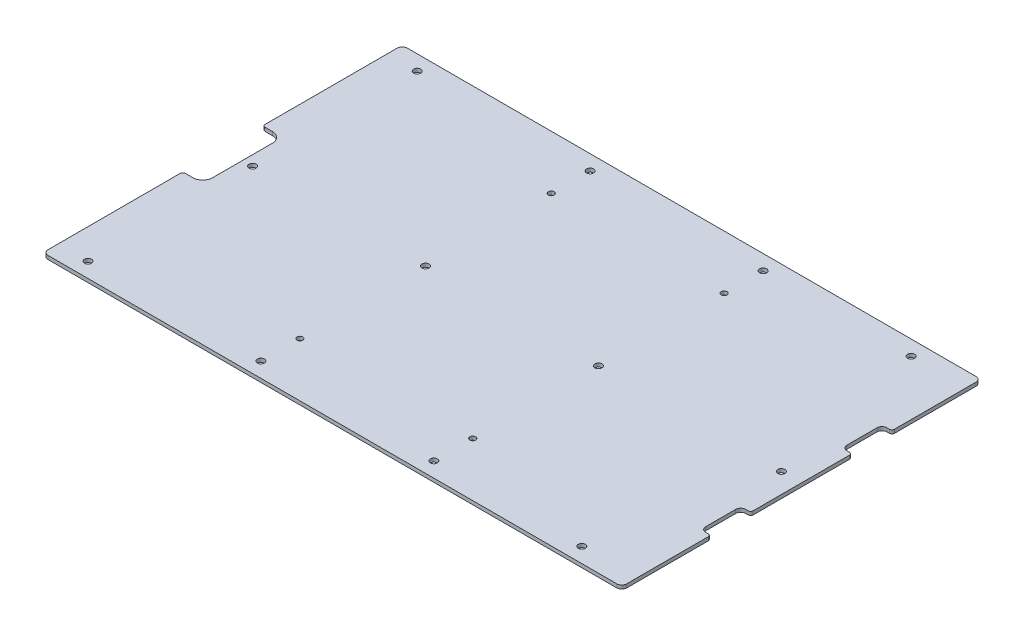
from build123d import *

# Parameters (mm, degrees)
SKETCH1_R           = 2.2479
SKETCH1_R_2         = 1.8288
BOSS_EXTRUDE1_DEPTH = 2.286
CUT_EXTRUDE1_DEPTH  = 217.750866886
FILLET1_R           = 1.5875


with BuildPart() as part:
    # Sketch1 → Boss-Extrude1 (new body)
    with BuildSketch(Plane(origin=(0, 0, 0), x_dir=(1, 0, 0), z_dir=(0, 1, 0))):
        with BuildLine():
            Line((-180.975, 114.3), (180.975, 114.3))
            ThreePointArc((180.975, 114.3), (183.22006403, 113.37006403), (184.15, 111.125))
            Line((184.15, 111.125), (184.15, -111.125))
            ThreePointArc((184.15, -111.125), (183.22006403, -113.37006403), (180.975, -114.3))
            Line((180.975, -114.3), (-180.975, -114.3))
            ThreePointArc((-180.975, -114.3), (-183.22006403, -113.37006403), (-184.15, -111.125))
            Line((-184.15, -111.125), (-184.15, 111.125))
            ThreePointArc((-184.15, 111.125), (-183.22006403, 113.37006403), (-180.975, 114.3))
        make_face()
        with Locations(Location((-165.1, 104.775, 0), (0, 0, 270))):
            Circle(SKETCH1_R, mode=Mode.SUBTRACT)
        with Locations(Location((-55.033333333, 104.775, 0), (0, 0, 270))):
            Circle(SKETCH1_R, mode=Mode.SUBTRACT)
        with Locations(Location((55.033333333, 104.775, 0), (0, 0, 270))):
            Circle(SKETCH1_R, mode=Mode.SUBTRACT)
        with Locations(Location((55.033333333, -104.775, 0), (0, 0, 270))):
            Circle(SKETCH1_R, mode=Mode.SUBTRACT)
        with Locations(Location((-55.033333333, -104.775, 0), (0, 0, 270))):
            Circle(SKETCH1_R, mode=Mode.SUBTRACT)
        with Locations(Location((-165.1, -104.775, 0), (0, 0, 270))):
            Circle(SKETCH1_R, mode=Mode.SUBTRACT)
        with Locations(Location((-55.033333333, 0, 0), (0, 0, 270))):
            Circle(SKETCH1_R, mode=Mode.SUBTRACT)
        with Locations(Location((55.033333333, 0, 0), (0, 0, 270))):
            Circle(SKETCH1_R, mode=Mode.SUBTRACT)
        with Locations(Location((149.225, -104.775, 0), (0, 0, 270))):
            Circle(SKETCH1_R, mode=Mode.SUBTRACT)
        with Locations(Location((149.225, 104.775, 0), (0, 0, 270))):
            Circle(SKETCH1_R, mode=Mode.SUBTRACT)
        with Locations(Location((55.0291, -80.01, 0), (0, 0, 270))):
            Circle(SKETCH1_R_2, mode=Mode.SUBTRACT)
        with Locations(Location((-55.0291, -80.01, 0), (0, 0, 270))):
            Circle(SKETCH1_R_2, mode=Mode.SUBTRACT)
        with Locations(Location((-55.0291, 80.01, 0), (0, 0, 270))):
            Circle(SKETCH1_R_2, mode=Mode.SUBTRACT)
        with Locations(Location((55.0291, 80.01, 0), (0, 0, 270))):
            Circle(SKETCH1_R_2, mode=Mode.SUBTRACT)
        with Locations(Location((171.45, 0, 0), (0, 0, 270))):
            Circle(SKETCH1_R, mode=Mode.SUBTRACT)
        with Locations(Location((-165.1, 0, 0), (0, 0, 270))):
            Circle(SKETCH1_R, mode=Mode.SUBTRACT)
    extrude(amount=BOSS_EXTRUDE1_DEPTH)

    # Sketch2 → Cut-Extrude1 (cut, through all)
    with BuildSketch(Plane.XZ):
        with BuildLine():
            Line((184.15, 57.658), (180.975, 57.658))
            ThreePointArc((180.975, 57.658), (178.72993597, 56.72806403), (177.8, 54.483))
            Line((177.8, 54.483), (177.8, 35.433))
            ThreePointArc((177.8, 35.433), (178.72993597, 33.18793597), (180.975, 32.258))
            Line((180.975, 32.258), (184.15, 32.258))
            Line((184.15, 32.258), (184.15, 57.658))
        make_face()
        with BuildLine():
            Line((184.15, -32.258), (180.975, -32.258))
            ThreePointArc((180.975, -32.258), (178.72993597, -33.18793597), (177.8, -35.433))
            Line((177.8, -35.433), (177.8, -54.483))
            ThreePointArc((177.8, -54.483), (178.72993597, -56.72806403), (180.975, -57.658))
            Line((180.975, -57.658), (184.15, -57.658))
            Line((184.15, -57.658), (184.15, -32.258))
        make_face()
        with BuildLine():
            Line((-184.15, 25.4), (-177.8, 25.4))
            ThreePointArc((-177.8, 25.4), (-173.309871939, 23.540128061), (-171.45, 19.05))
            Line((-171.45, 19.05), (-171.45, -19.05))
            ThreePointArc((-171.45, -19.05), (-173.309871939, -23.540128061), (-177.8, -25.4))
            Line((-177.8, -25.4), (-184.15, -25.4))
            Line((-184.15, -25.4), (-184.15, 25.4))
        make_face()
    extrude(amount=-CUT_EXTRUDE1_DEPTH, mode=Mode.SUBTRACT)

    # Fillet1
    fillet1_edges = [part.edges().sort_by_distance(p)[0] for p in [
        (184.15, 1.143, 57.658),
        (184.15, 1.143, 32.258),
        (184.15, 1.143, -32.258),
        (184.15, 1.143, -57.658),
        (-184.15, 1.143, -25.4),
        (-184.15, 1.143, 25.4),
    ]]
    fillet(fillet1_edges, radius=FILLET1_R)


solid = part.part
